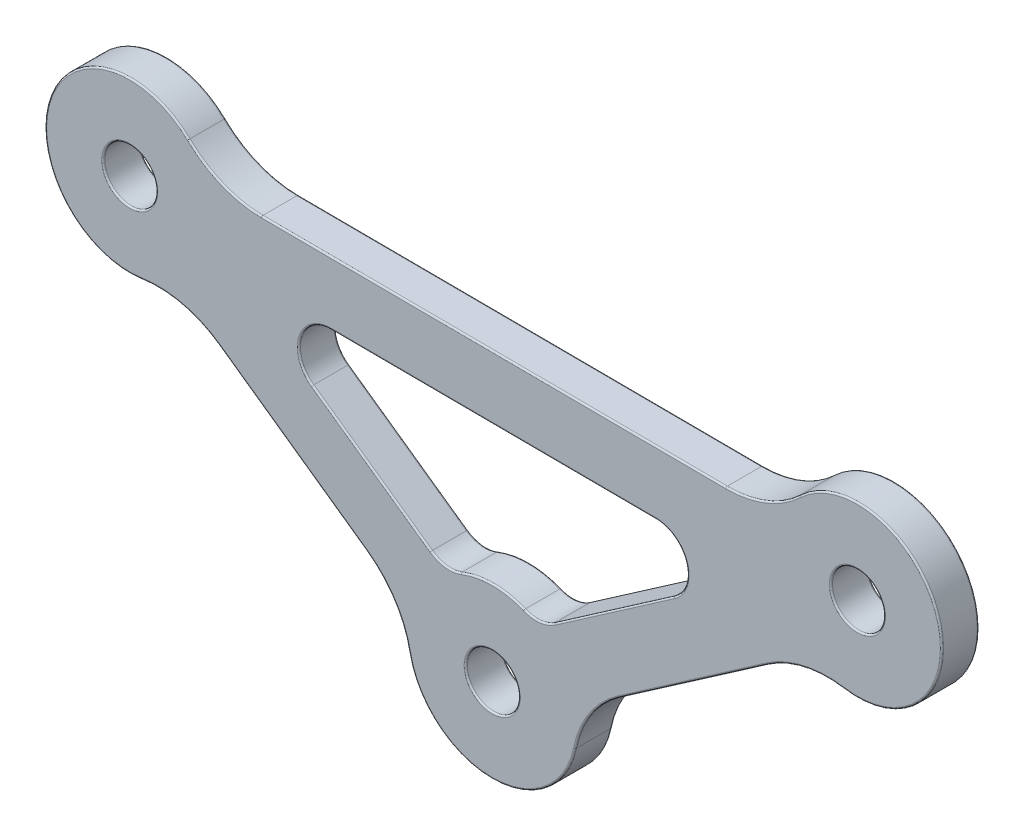
from build123d import *

# Parameters (mm, degrees)
SKETCH2_R             = 8
SKETCH2_R_2           = 2.5
BOSS_EXTRUDE1_DEPTH   = 3.5
BOSS_EXTRUDE1_2_DEPTH = 3.5
BOSS_EXTRUDE1_3_DEPTH = 3.5
EXTRUDE_THIN1_DEPTH   = 3.5
FILLET1_R             = 3
FILLET2_R             = 10
FILLET3_R             = 0.15


with BuildPart() as part:
    # Sketch2 → Boss-Extrude1 (new body)
    with BuildSketch(Plane.XY):
        with Locations((-59.132373656, 229.773458532)):
            Circle(SKETCH2_R)
        with Locations((-59.132373656, 229.773458532)):
            Circle(SKETCH2_R_2, mode=Mode.SUBTRACT)
    extrude(amount=-BOSS_EXTRUDE1_DEPTH)



with BuildPart() as body_2:
    # Sketch2 → Boss-Extrude1 2 (new body)
    with BuildSketch(Plane.XY):
        with Locations((-24.851714699, 205.507506634)):
            Circle(SKETCH2_R)
        with Locations((-24.851714699, 205.507506634)):
            Circle(SKETCH2_R_2, mode=Mode.SUBTRACT)
    extrude(amount=-BOSS_EXTRUDE1_2_DEPTH)


with BuildPart() as body_3:
    # Sketch2 → Boss-Extrude1 3 (new body)
    with BuildSketch(Plane.XY):
        with Locations((9.675497125, 229.421344545)):
            Circle(SKETCH2_R)
        with Locations((9.675497125, 229.421344545)):
            Circle(SKETCH2_R_2, mode=Mode.SUBTRACT)
    extrude(amount=-BOSS_EXTRUDE1_3_DEPTH)


with BuildPart() as part_1:
    add(part.part)

    add(body_2.part)  # Extrude-Thin1 merges body 2

    add(body_3.part)  # Extrude-Thin1 merges body 3
    # Sketch4 → Extrude-Thin1 (add)
    with BuildSketch(Plane.XY):
        Polygon((-52.243790116, 226.738167955), (2.756209884, 226.456713682), (2.786913585, 232.456635122), (-52.213086415, 232.738089395), align=None)
        Polygon((3.034907014, 228.471311402), (-21.627387146, 211.389998609), (-18.211124588, 206.457539777), (6.451169572, 223.53885257), align=None)
        Polygon((-55.96841894, 223.858275478), (-31.482233971, 206.525452694), (-28.015669415, 211.422689688), (-52.501854383, 228.755512472), align=None)
    extrude(amount=-EXTRUDE_THIN1_DEPTH)

    # Fillet1
    fillet1_edges = [part_1.edges().sort_by_distance(p)[0] for p in [
        (0.145485449, 226.470073674, -1.75),
        (-20.463163691, 212.196349587, -1.75),
        (-29.171579351, 212.240913601, -1.75),
        (-49.63306568, 226.724807963, -1.75),
    ]]
    fillet(fillet1_edges, radius=FILLET1_R)

    # Fillet2
    fillet2_edges = [part_1.edges().sort_by_distance(p)[0] for p in [
        (-51.700920421, 232.735468462, -1.75),
        (2.274747591, 232.459256054, -1.75),
        (5.286946117, 222.732501592, -1.75),
        (-17.046901132, 207.263890755, -1.75),
        (-32.638143908, 207.343676607, -1.75),
        (-54.812509003, 223.040051565, -1.75),
    ]]
    fillet(fillet2_edges, radius=FILLET2_R)

    # Fillet3
    fillet3_edges = [part_1.edges().sort_by_distance(p)[0] for p in [
        (-24.743790116, 226.597440819, 0),
        (-24.743790116, 226.597440819, -3.5),
        (-36.255260716, 217.255177518, 0),
        (-36.255260716, 217.255177518, -3.5),
        (-13.328535173, 217.13785343, 0),
        (-13.328535173, 217.13785343, -3.5),
        (-24.810776432, 213.507401887, -3.5),
        (-24.810776432, 213.507401887, 0),
        (-42.990254703, 224.592904302, -3.5),
        (-42.990254703, 224.592904302, 0),
        (-6.518796448, 224.406267069, -3.5),
        (-6.518796448, 224.406267069, 0),
        (-20.363004202, 212.707106571, -3.5),
        (-20.363004202, 212.707106571, 0),
        (-29.266506287, 212.752668911, 0),
        (-29.266506287, 212.752668911, -3.5),
        (-66.749698988, 232.218116949, 0),
        (-66.749698988, 232.218116949, -3.5),
        (-24.713086415, 232.597362258, 0),
        (-24.713086415, 232.597362258, -3.5),
        (17.317443207, 231.787915923, 0),
        (17.317443207, 231.787915923, -3.5),
        (-5.879977508, 214.998196173, 0),
        (-5.879977508, 214.998196173, -3.5),
        (-24.892652967, 197.507611381, -3.5),
        (-24.892652967, 197.507611381, 0),
        (-43.725326456, 215.191864086, 0),
        (-43.725326456, 215.191864086, -3.5),
        (-50.390329931, 233.449163872, -3.5),
        (-50.390329931, 233.449163872, 0),
        (0.971530009, 233.186327237, -3.5),
        (0.971530009, 233.186327237, 0),
        (4.622732107, 221.396152715, -3.5),
        (4.622732107, 221.396152715, 0),
        (-15.562336887, 207.415803806, -3.5),
        (-15.562336887, 207.415803806, 0),
        (-34.121075658, 207.510775376, 0),
        (-34.121075658, 207.510775376, -3.5),
        (-54.162006554, 221.696974823, -3.5),
        (-54.162006554, 221.696974823, 0),
        (7.175497125, 229.421344545, -3.5),
        (7.175497125, 229.421344545, 0),
        (-61.632373656, 229.773458532, -3.5),
        (-61.632373656, 229.773458532, 0),
        (-27.351714699, 205.507506634, -3.5),
        (-27.351714699, 205.507506634, 0),
    ]]
    fillet(fillet3_edges, radius=FILLET3_R)


solid = part_1.part
